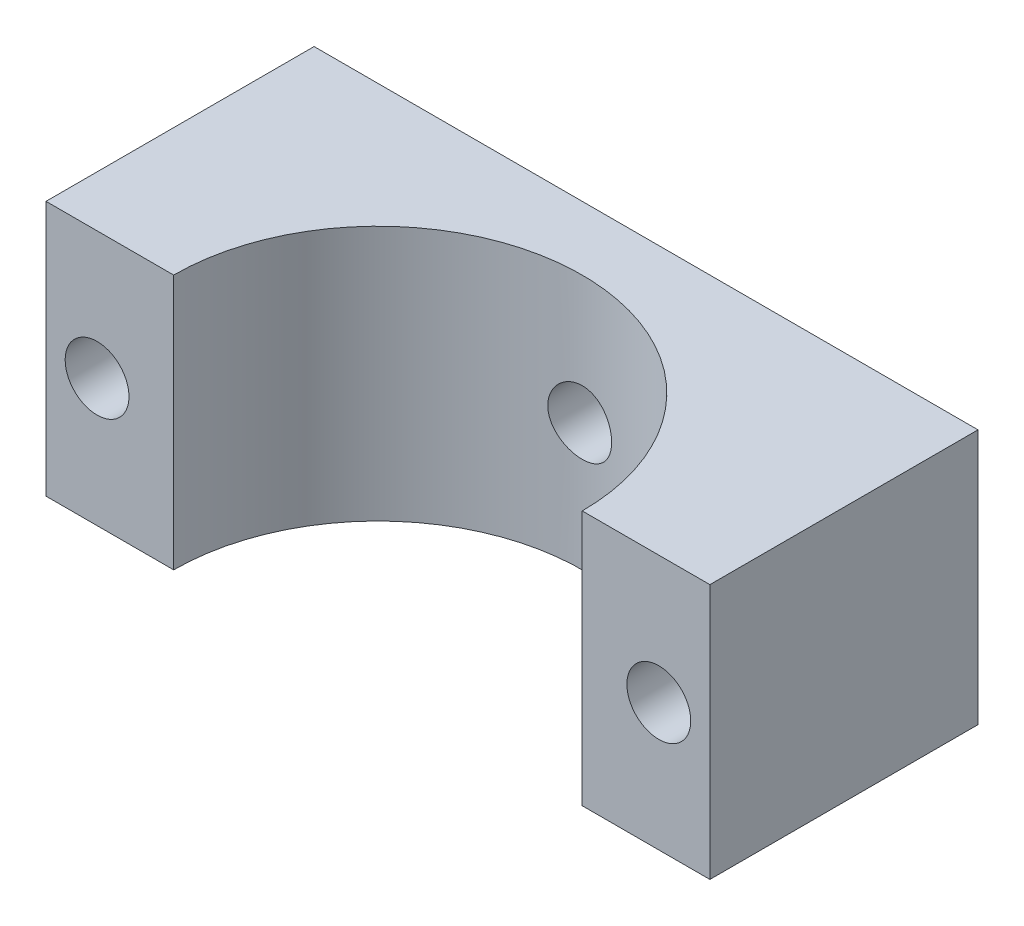
from build123d import *

# Parameters (mm, degrees)
EXTRUDE_1_DEPTH     = 10
SKETCH_2_R          = 1.25
CUT_EXTRUDE_2_DEPTH = 13


with BuildPart() as part:
    # 草图1 → 凸台-拉伸1 (new body)
    with BuildSketch(Plane(origin=(0, 0, 0), x_dir=(1, 0, 0), z_dir=(0, 1, 0))):
        with BuildLine():
            Line((8, 0), (13, 0))
            Line((13, 0), (13, 10.5))
            Line((13, 10.5), (-13, 10.5))
            Line((-13, 10.5), (-13, 0))
            Line((-13, 0), (-8, 0))
            ThreePointArc((-8, 0), (0, 8), (8, 0))
        make_face()
    extrude(amount=EXTRUDE_1_DEPTH)

    # 草图2 → 切除-拉伸2 (cut)
    with BuildSketch(Plane(origin=(0, 0, -10.5), x_dir=(-1, 0, 0), z_dir=(0, 0, -1))):
        with Locations((-11, 5)):
            Circle(SKETCH_2_R)
        with Locations((0, 5)):
            Circle(SKETCH_2_R)
        with Locations((11, 5)):
            Circle(SKETCH_2_R)
    extrude(amount=-CUT_EXTRUDE_2_DEPTH, mode=Mode.SUBTRACT)


solid = part.part
